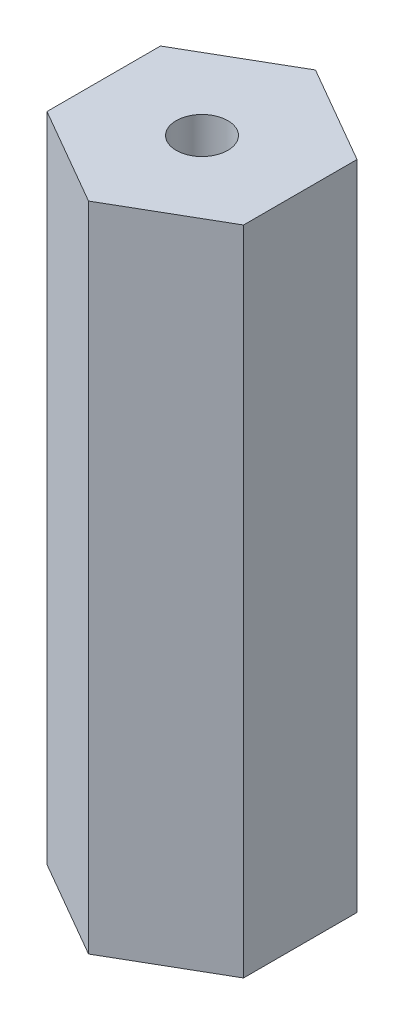
from build123d import *

# Parameters (mm, degrees)
BOSS_EXTRUDE1_DEPTH = 15
SKETCH3_R           = 0.593671867
CUT_EXTRUDE1_DEPTH  = 16.392337775


with BuildPart() as part:
    # Sketch1 → Boss-Extrude1 (new body)
    with BuildSketch(Plane(origin=(0, 0, 0), x_dir=(1, 0, 0), z_dir=(0, 1, 0))):
        Polygon((2.2606, 1.305158019), (0, 2.610316037), (-2.2606, 1.305158019), (-2.2606, -1.305158019), (0, -2.610316037), (2.2606, -1.305158019), align=None)
    extrude(amount=BOSS_EXTRUDE1_DEPTH)

    # Sketch3 → Cut-Extrude1 (cut, through all)
    with BuildSketch(Plane(origin=(0, 15, 0), x_dir=(1, 0, 0), z_dir=(0, 1, 0))):
        with Locations(Location((0, 0, 0), (0, 0, 270))):
            Circle(SKETCH3_R)
    extrude(amount=-CUT_EXTRUDE1_DEPTH, mode=Mode.SUBTRACT)


solid = part.part
